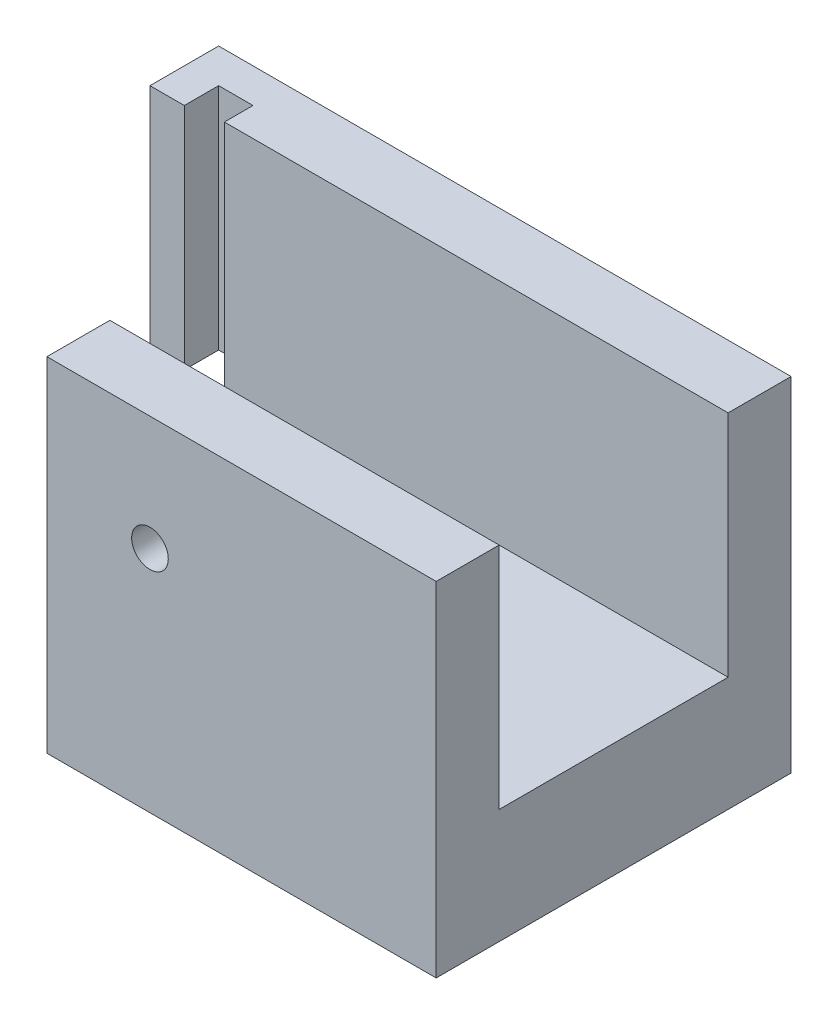
from build123d import *

# Parameters (mm, degrees)
BOSS_EXTRUDE1_DEPTH       = 15
SKETCH2_W                 = 22
SKETCH2_H                 = 10
CUT_EXTRUDE1_DEPTH        = 10
M2X0_4_TAPPED_HOLE1_D     = 1.6
M2X0_4_TAPPED_HOLE1_DEPTH = 2.75
SKETCH6_W                 = 3
SKETCH6_H                 = 15.5
CUT_EXTRUDE2_DEPTH        = 5
SKETCH7_W                 = 3
SKETCH7_H                 = 10
CUT_EXTRUDE4_DEPTH        = 3
CUT_EXTRUDE5_REACH        = 35.019
SKETCH8_W                 = 5
SKETCH8_H                 = 15


with BuildPart() as part:
    # Sketch1 → Boss-Extrude1 (new body)
    with BuildSketch(Plane(origin=(0, 0, 0), x_dir=(1, 0, 0), z_dir=(0, 1, 0))):
        Polygon((0, -0.563585479), (0, -3.563585479), (25, -3.563585479), (25, 11.936414521), (0, 11.936414521), (0, 8.936414521), (1.5, 8.936414521), (1.5, 10.436414521), (3, 10.436414521), (3, -2.063585479), (1.5, -2.063585479), (1.5, -0.563585479), align=None)
    extrude(amount=BOSS_EXTRUDE1_DEPTH)

    # Sketch2 → Cut-Extrude1 (cut)
    with BuildSketch(Plane(origin=(0, 15, 0), x_dir=(1, 0, 0), z_dir=(0, 1, 0))):
        with Locations((14, 4.186414521)):
            Rectangle(SKETCH2_W, SKETCH2_H)
    extrude(amount=-CUT_EXTRUDE1_DEPTH, mode=Mode.SUBTRACT)

    # M2x0.4 Tapped Hole1
    with Locations(Plane.XY.offset(3.563585479)):
        with Locations((12.5, 10)):
            Hole(M2X0_4_TAPPED_HOLE1_D / 2, depth=M2X0_4_TAPPED_HOLE1_DEPTH)

    # Sketch6 → Cut-Extrude2 (cut)
    with BuildSketch(Plane.XZ):
        with Locations((1.5, -4.186414521)):
            Rectangle(SKETCH6_W, SKETCH6_H)
    extrude(amount=-CUT_EXTRUDE2_DEPTH, mode=Mode.SUBTRACT)

    # Sketch7 → Cut-Extrude4 (cut)
    with BuildSketch(Plane.XY.offset(3.563585479)):
        with Locations((1.5, 10)):
            Rectangle(SKETCH7_W, SKETCH7_H)
    extrude(amount=-CUT_EXTRUDE4_DEPTH, mode=Mode.SUBTRACT)

    # Cut-Extrude5: up to this face of the body (flat: up to its plane)
    cut_extrude5_end = Plane(part.part.faces().sort_by_distance((14, 10, -9.186414521))[0])
    # Sketch8 → Cut-Extrude5 (cut, up to the picked face)
    with BuildSketch(Plane.XY.offset(3.563585479), mode=Mode.PRIVATE) as cut_extrude5_sk1:
        with Locations((5.5, 7.5)):
            Rectangle(SKETCH8_W, SKETCH8_H)
    cut_extrude5_tool1 = split(extrude(cut_extrude5_sk1.sketch, amount=-CUT_EXTRUDE5_REACH, mode=Mode.PRIVATE), bisect_by=cut_extrude5_end, keep=Keep.BOTH, mode=Mode.PRIVATE)
    add(cut_extrude5_tool1.solids().sort_by(Axis((5.5, 7.5, 3.563585), (0, 0, -1)))[0], mode=Mode.SUBTRACT)


solid = part.part
